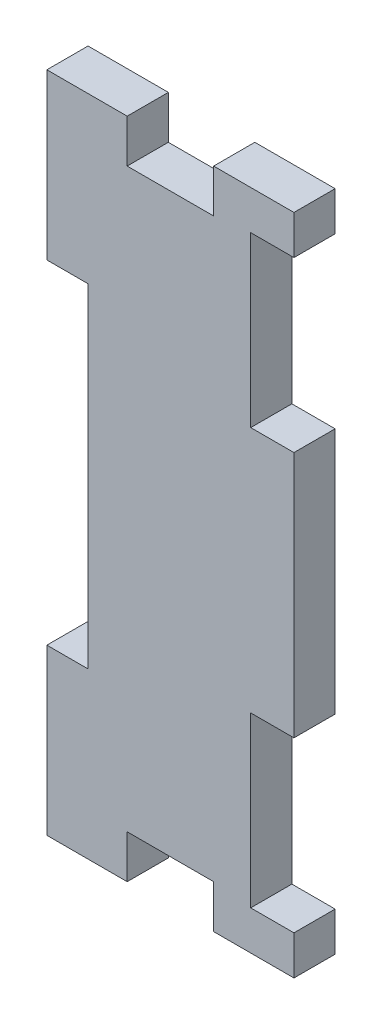
from build123d import *

# Parameters (mm, degrees)
BOSS_EXTRUDE1_DEPTH = 2.5


with BuildPart() as part:
    # Sketch2 → Boss-Extrude1 (new, symmetric)
    with BuildSketch(Plane.XY):
        Polygon((113.746163942, -98.757408203), (108.496163942, -98.757408203), (108.496163942, -78.257408203), (113.746163942, -78.257408203), (113.746163942, -73.507408203), (103.996163942, -73.507408203), (103.996163942, -78.757408203), (93.496163942, -78.757408203), (93.496163942, -73.507408203), (83.746163942, -73.507408203), (83.746163942, -93.507408203), (88.746163942, -93.507408203), (88.746163942, -134.007377288), (83.746163942, -134.007377288), (83.746163942, -154.007377288), (93.496163942, -154.007377288), (93.496163942, -148.757377288), (103.996163942, -148.757377288), (103.996163942, -154.007377288), (113.746163942, -154.007377288), (113.746163942, -149.257377288), (108.496163942, -149.257377288), (108.496163942, -128.757377288), (113.746163942, -128.757377288), align=None)
    extrude(amount=BOSS_EXTRUDE1_DEPTH, both=True)


solid = part.part
